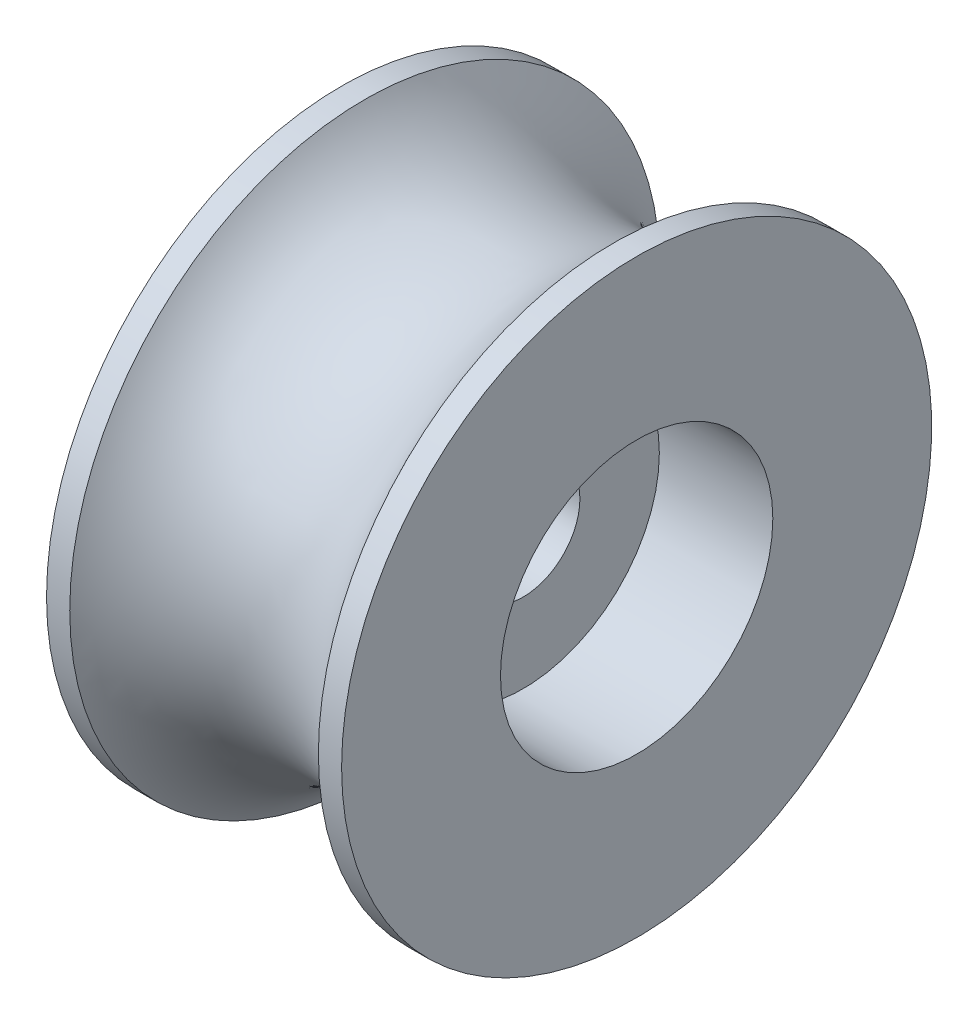
from build123d import *

# Parameters (mm, degrees)
SKETCH_2_R          = 2.5
CUT_EXTRUDE_1_DEPTH = 55
SKETCH_3_R          = 6
CUT_EXTRUDE_2_DEPTH = 5
CUT_EXTRUDE_START   = -5
SKETCH_4_R          = 6
CUT_EXTRUDE_3_DEPTH = 5


with BuildPart() as part:
    # 草图1 → 旋转1 (revolve)
    with BuildSketch(Plane(origin=(0, 0, 0), x_dir=(1, 0, 0), z_dir=(0, 1, 0)), mode=Mode.PRIVATE) as revolve_1_sk:
        with BuildLine():
            Line((-6.5, 6.5), (-6.5, -6.5))
            Line((-6.5, -6.5), (6.5, -6.5))
            Line((6.5, -6.5), (6.5, 6.5))
            Line((6.5, 6.5), (5.477225575, 6.5))
            ThreePointArc((5.477225575, 6.5), (0, 3.5), (-5.477225575, 6.5))
            Line((-5.477225575, 6.5), (-6.5, 6.5))
        make_face()
    revolve(revolve_1_sk.sketch.rotate(Axis((-6.5, 0, 6.5), (1, 0, 0)), 180), axis=Axis((-6.5, 0, 6.5), (1, 0, 0)))

    # 草图2 → 切除-拉伸1 (cut)
    with BuildSketch(Plane(origin=(6.5, 0, 0), x_dir=(0, 0, -1), z_dir=(1, 0, 0))):
        with Locations((-6.5, 0)):
            Circle(SKETCH_2_R)
    extrude(amount=-CUT_EXTRUDE_1_DEPTH, mode=Mode.SUBTRACT)

    # 草图3 → 切除-拉伸2 (cut)
    with BuildSketch(Plane(origin=(6.5, 0, 0), x_dir=(0, 0, -1), z_dir=(1, 0, 0))):
        with Locations((-6.5, 0)):
            Circle(SKETCH_3_R)
    extrude(amount=-CUT_EXTRUDE_2_DEPTH, mode=Mode.SUBTRACT)

    # 草图4 → 切除-拉伸3 (cut)
    with BuildSketch(Plane.ZY.offset(6.5).offset(CUT_EXTRUDE_START)):
        with Locations(Location((6.5, 0, 0), (0, 0, 180))):
            Circle(SKETCH_4_R)
    extrude(amount=CUT_EXTRUDE_3_DEPTH, mode=Mode.SUBTRACT)


solid = part.part
